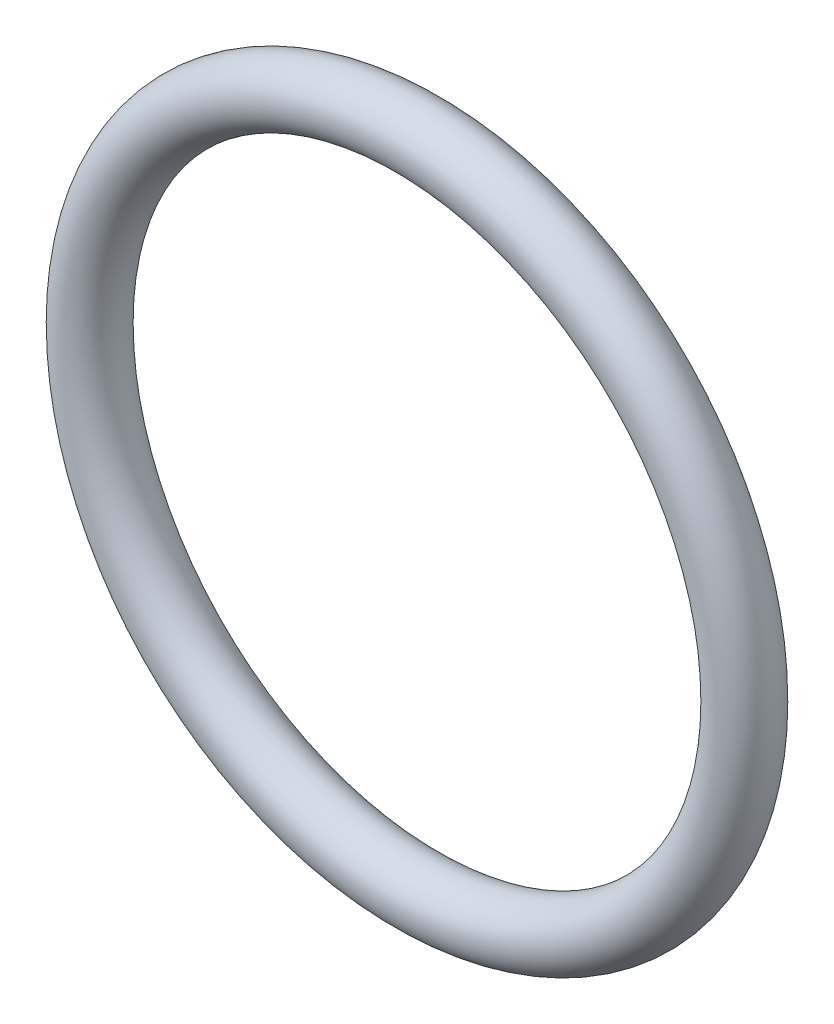
from build123d import *

# Parameters (mm, degrees)
SKETCH1_R = 0.89


with BuildPart() as part:
    # Sketch1 → Revolve1 (revolve)
    with BuildSketch(Plane(origin=(0, 0, 0), x_dir=(0, 0, -1), z_dir=(1, 0, 0)), mode=Mode.PRIVATE) as revolve1_sk:
        with Locations((0, 9.475)):
            Circle(SKETCH1_R)
    revolve(revolve1_sk.sketch.rotate(Axis((0, 0, 0), (0, 0, -1)), 90), axis=Axis((0, 0, 0), (0, 0, -1)))


solid = part.part
